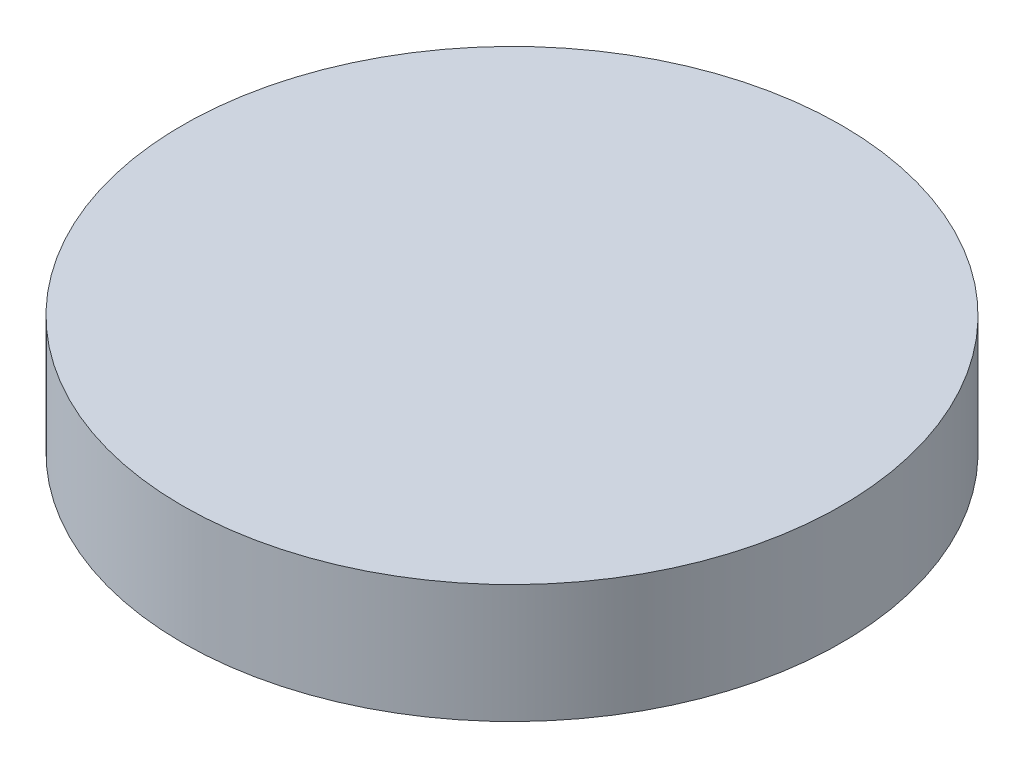
from build123d import *

# Parameters (mm, degrees)
SKETCH_1_R      = 12.5
EXTRUDE_1_DEPTH = 4.5


with BuildPart() as part:
    # 草图1 → 凸台-拉伸1 (new body)
    with BuildSketch(Plane(origin=(0, 0, 0), x_dir=(1, 0, 0), z_dir=(0, 1, 0))):
        with Locations(Location((0, 0, 0), (0, 0, 270))):
            Circle(SKETCH_1_R)
    extrude(amount=EXTRUDE_1_DEPTH)


solid = part.part
